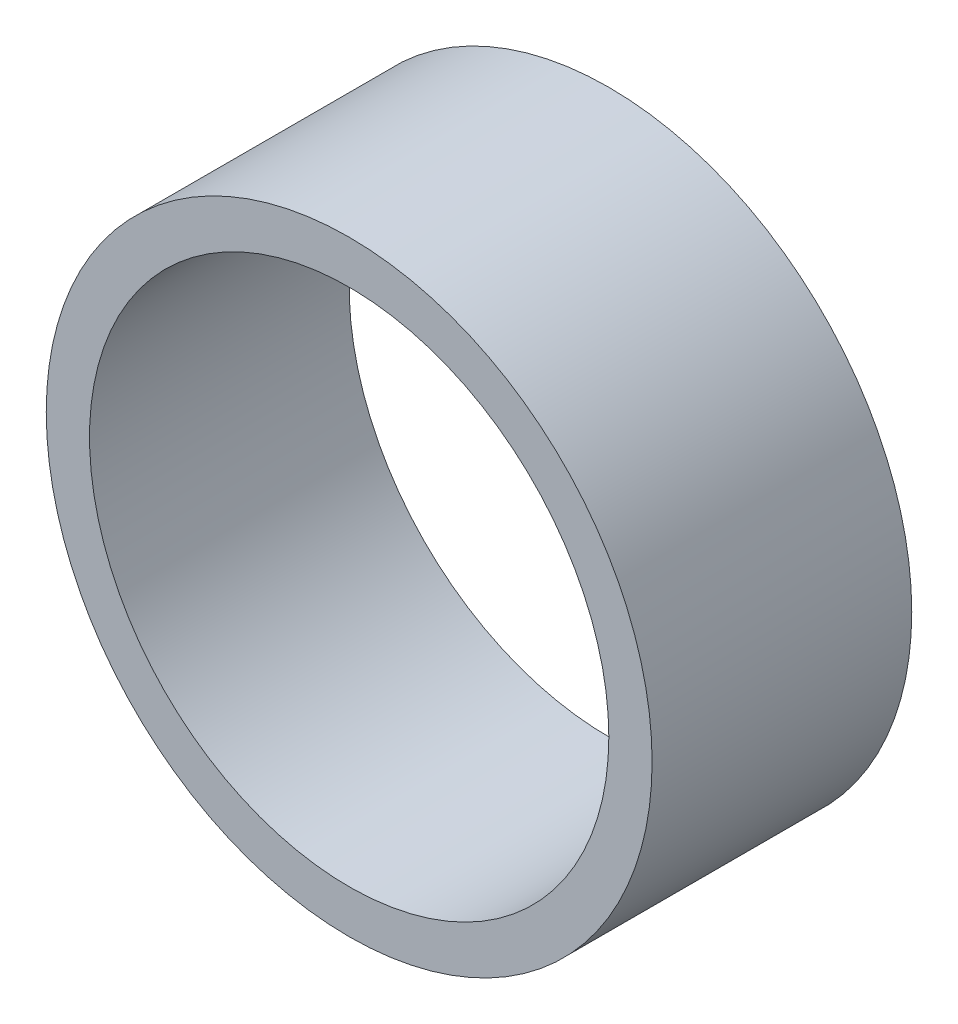
from build123d import *

# Parameters (mm, degrees)
SKETCH1_R           = 17.5
SKETCH1_R_2         = 15
BOSS_EXTRUDE1_DEPTH = 15


with BuildPart() as part:
    # Sketch1 → Boss-Extrude1 (new body)
    with BuildSketch(Plane.XY):
        Circle(SKETCH1_R)
        Circle(SKETCH1_R_2, mode=Mode.SUBTRACT)
    extrude(amount=BOSS_EXTRUDE1_DEPTH)


solid = part.part
